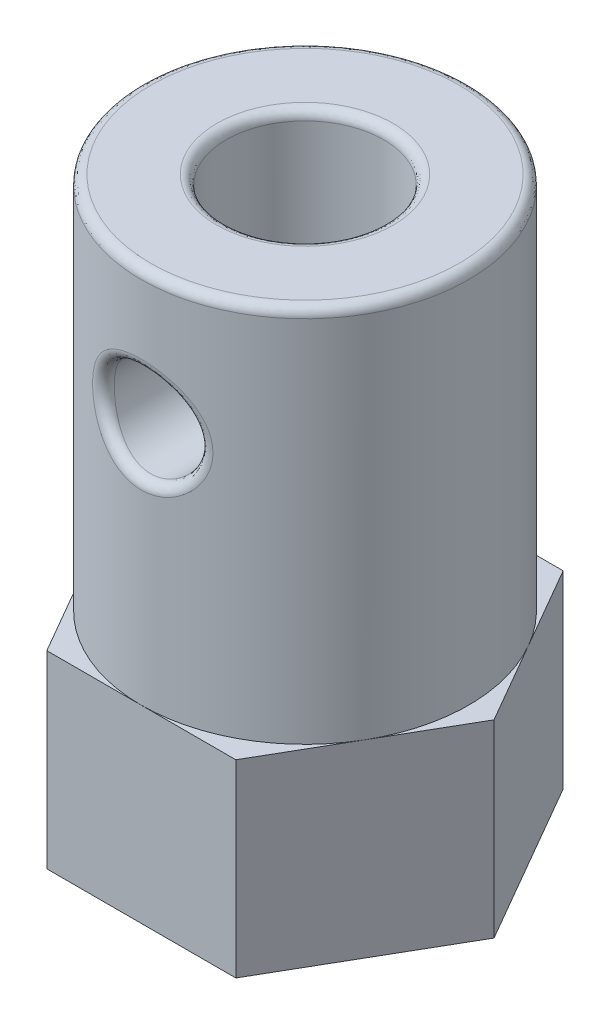
from build123d import *

# Parameters (mm, degrees)
BOSS_EXTRUDE2_DEPTH = 6
SKETCH3_R           = 5.196152423
SKETCH3_R_2         = 2.5
BOSS_EXTRUDE4_DEPTH = 12
CUT_EXTRUDE2_REACH  = 21.672
SKETCH1_4_R         = 2
CUT_EXTRUDE3_REACH  = 23.633
SKETCH4_R           = 1.5
FILLET3_R           = 0.3


with BuildPart() as part:
    # Sketch1 → Boss-Extrude2 (new body)
    with BuildSketch(Plane(origin=(0, 0, 0), x_dir=(1, 0, 0), z_dir=(0, 1, 0))):
        Polygon((-3, 5.196152423), (-6, 0), (-3, -5.196152423), (3, -5.196152423), (6, 0), (3, 5.196152423), align=None)
    extrude(amount=BOSS_EXTRUDE2_DEPTH)

    # Sketch3 → Boss-Extrude4 (add)
    with BuildSketch(Plane(origin=(0, 6, 0), x_dir=(1, 0, 0), z_dir=(0, 1, 0))):
        Circle(SKETCH3_R)
        Circle(SKETCH3_R_2, mode=Mode.SUBTRACT)
    extrude(amount=BOSS_EXTRUDE4_DEPTH)

    # Sketch1<4> → Cut-Extrude2 (cut, up to next)
    with BuildSketch(Plane(origin=(0, 0, 0), x_dir=(1, 0, 0), z_dir=(0, 1, 0)), mode=Mode.PRIVATE) as cut_extrude2_sk1:
        Circle(SKETCH1_4_R)
    cut_extrude2_tool1 = extrude(cut_extrude2_sk1.sketch, amount=CUT_EXTRUDE2_REACH, mode=Mode.PRIVATE) & part.part
    add(cut_extrude2_tool1.solids().sort_by_distance((0, 0, 0))[0], mode=Mode.SUBTRACT)

    # Sketch4 → Cut-Extrude3 (cut, up to next)
    with BuildSketch(Plane.XY.offset(5.196152423), mode=Mode.PRIVATE) as cut_extrude3_sk1:
        with Locations((0, 13.714512782)):
            Circle(SKETCH4_R)
    cut_extrude3_tool1 = extrude(cut_extrude3_sk1.sketch, amount=-CUT_EXTRUDE3_REACH, mode=Mode.PRIVATE) & part.part
    add(cut_extrude3_tool1.solids().sort_by_distance((0, 13.714513, 5.196152))[0], mode=Mode.SUBTRACT)

    # Fillet3
    fillet3_edges = [part.edges().sort_by_distance(p)[0] for p in [
        (-2, 0, 0),
        (-1.499999989, 13.714512781, 4.974937195),
        (-2.5, 18, 0),
        (-5.196152423, 18, 0),
    ]]
    fillet(fillet3_edges, radius=FILLET3_R)


solid = part.part
